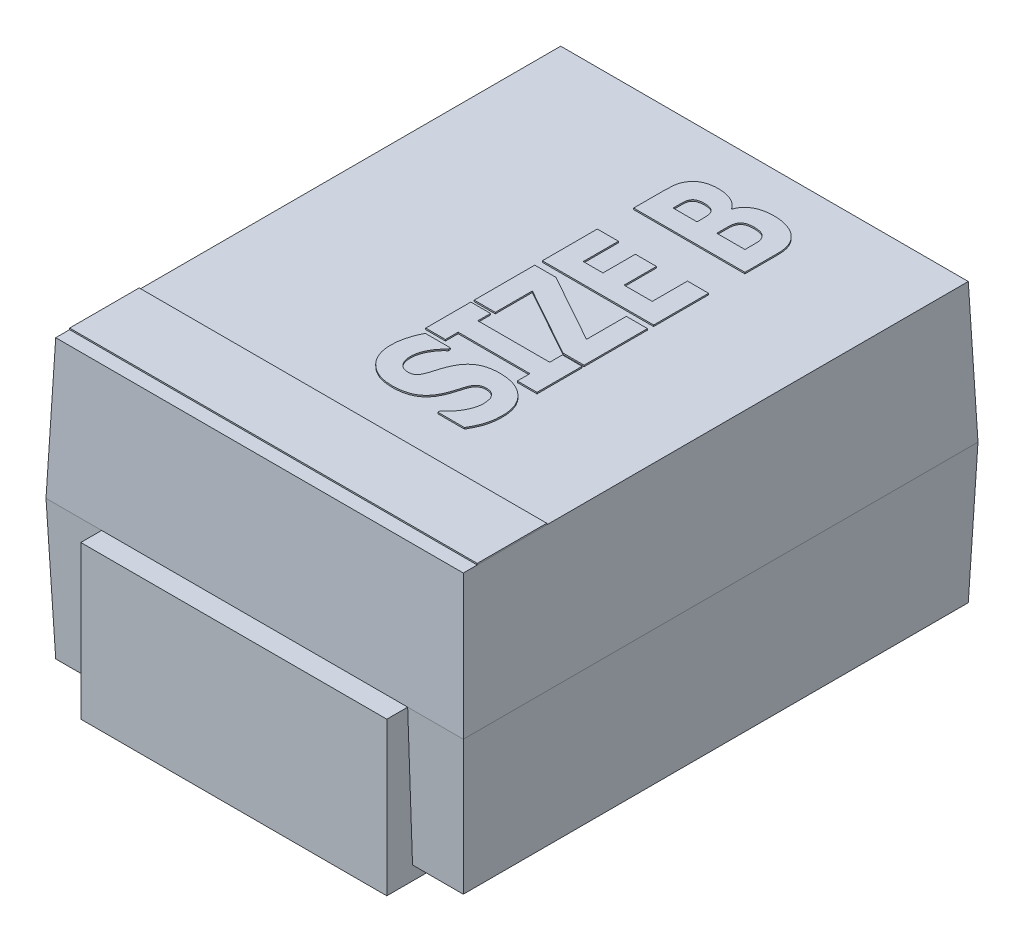
from build123d import *

# Parameters (mm, degrees)
SKETCH1_W                     = 3
SKETCH1_H                     = 3.7
BOSS_EXTRUDE1_DEPTH           = 1
BOSS_EXTRUDE1_TAPER           = 2
BOSS_EXTRUDE1_OTHER_WAY_DEPTH = 1
BOSS_EXTRUDE1_OTHER_WAY_TAPER = 2
BOSS_EXTRUDE2_DEPTH           = 0.1
BOSS_EXTRUDE2_DEPTH_BACK      = 1
SKETCH2_W                     = 2.2
SKETCH2_H                     = 1.35
SKETCH3_W                     = 2.930158462
SKETCH3_H                     = 0.5
EXTRUDE_THIN1_DEPTH           = 0.01
BOSS_EXTRUDE3_DEPTH           = 0.01


with BuildPart() as part:
    # Sketch1 → Boss-Extrude1 (new body)
    with BuildSketch(Plane(origin=(0, 0, 0), x_dir=(1, 0, 0), z_dir=(0, 1, 0))):
        Rectangle(SKETCH1_W, SKETCH1_H)
    extrude(amount=BOSS_EXTRUDE1_DEPTH, taper=BOSS_EXTRUDE1_TAPER)

    # Sketch1 → Boss-Extrude1 other way (add)
    with BuildSketch(Plane(origin=(0, 0, 0), x_dir=(1, 0, 0), z_dir=(0, 1, 0))):
        Rectangle(SKETCH1_W, SKETCH1_H)
    extrude(amount=-BOSS_EXTRUDE1_OTHER_WAY_DEPTH, taper=BOSS_EXTRUDE1_OTHER_WAY_TAPER)

    # Sketch2 → Boss-Extrude2 (add, two sides: drawn at the far end of the back side and taken through both)
    with BuildSketch(Plane.XZ.offset(1).offset(-BOSS_EXTRUDE2_DEPTH_BACK)):
        with Locations((0, 1.325)):
            Rectangle(SKETCH2_W, SKETCH2_H)
        with Locations((0, -1.325)):
            Rectangle(SKETCH2_W, SKETCH2_H)
    extrude(amount=BOSS_EXTRUDE2_DEPTH + BOSS_EXTRUDE2_DEPTH_BACK)

    # Sketch3 → Extrude-Thin1 (add)
    with BuildSketch(Plane(origin=(0, 1, 0), x_dir=(1, 0, 0), z_dir=(0, 1, 0))):
        with Locations((0, -1.465079231)):
            Rectangle(SKETCH3_W, SKETCH3_H)
    extrude(amount=EXTRUDE_THIN1_DEPTH)

    # Sketch4 → Boss-Extrude3 (add)
    # profile 1 of 5: a face of its own
    with BuildSketch(Plane(origin=(0, 1, 0), x_dir=(1, 0, 0), z_dir=(0, 1, 0))):
        with BuildLine():
            add(Edge.make_bspline(
                [(0.365712142, -0.449367089), (0.375477587, -0.449585808), (0.394586509, -0.450013797), (0.422548964, -0.453184881), (0.449056815, -0.458587497), (0.474219127, -0.465954588), (0.497898983, -0.475738978), (0.520333789, -0.487348438), (0.5411446, -0.501493547), (0.560614091, -0.517348749), (0.578125113, -0.535178263), (0.593466319, -0.55464831), (0.606472344, -0.575606586), (0.61721107, -0.598066109), (0.625217682, -0.622182753), (0.631022844, -0.647776451), (0.634817357, -0.674887089), (0.635158268, -0.693499619), (0.635332395, -0.703006329)],
                knots=[0, 0, 0, 0, 1.123231077, 2.197926755, 3.231931198, 4.23205902, 5.208893471, 6.175023653, 7.132504262, 8.098119942, 9.059150163, 10.001029427, 10.943846196, 11.890986852, 12.857973929, 13.860252586, 14.907082517, 16, 16, 16, 16], degree=3))
            add(Edge.make_bspline(
                [(0.635332395, -0.703006329), (0.635115242, -0.713931024), (0.634694654, -0.735090239), (0.631588553, -0.765807235), (0.626063457, -0.794334312), (0.618402145, -0.820873007), (0.608794987, -0.84570026), (0.598367575, -0.869706339), (0.586750204, -0.892933672), (0.577981534, -0.907800906), (0.573623534, -0.915189873)],
                knots=[0, 0, 0, 0, 1.170088317, 2.26625562, 3.302187664, 4.278401643, 5.220628038, 6.151609465, 7.08135594, 8, 8, 8, 8], degree=3))
            Line((0.573623534, -0.915189873), (0.382167838, -0.915189873))
            Line((0.382167838, -0.915189873), (0.382167838, -0.899683544))
            add(Edge.make_bspline(
                [(0.382167838, -0.899683544), (0.39076958, -0.892313259), (0.40765476, -0.877845423), (0.429750751, -0.853608827), (0.449012854, -0.828315552), (0.464822603, -0.801871713), (0.477559335, -0.77513376), (0.486597859, -0.748530664), (0.492575969, -0.722470456), (0.493237066, -0.705146194), (0.493560243, -0.696677215)],
                knots=[0, 0, 0, 0, 1.137748405, 2.233394795, 3.289549256, 4.328854387, 5.325001514, 6.260582723, 7.149684573, 8, 8, 8, 8], degree=3))
            add(Edge.make_bspline(
                [(0.493560243, -0.696677215), (0.493321944, -0.691659384), (0.492782712, -0.680304872), (0.490523317, -0.665704671), (0.488072343, -0.653007303), (0.485358825, -0.643929962), (0.48231823, -0.635644224), (0.479445586, -0.630818747), (0.478053914, -0.628481013)],
                knots=[0, 0, 0, 0, 1.279356194, 2.894969178, 3.759536177, 4.571858236, 5.308127055, 6, 6, 6, 6], degree=3))
            add(Edge.make_bspline(
                [(0.478053914, -0.628481013), (0.474196176, -0.623341147), (0.466520621, -0.613114603), (0.453759433, -0.602916998), (0.441713169, -0.596657245), (0.430547317, -0.593457824), (0.417529837, -0.591395282), (0.408179361, -0.591228069), (0.403212142, -0.591139241)],
                knots=[0, 0, 0, 0, 1.313748587, 2.613902296, 3.305346579, 4.085142053, 4.982776842, 6, 6, 6, 6], degree=3))
            add(Edge.make_bspline(
                [(0.403212142, -0.591139241), (0.398870896, -0.591308505), (0.390457131, -0.591636557), (0.378273869, -0.594577743), (0.367106465, -0.599552837), (0.356824495, -0.606408714), (0.347847994, -0.615320347), (0.339539697, -0.625681128), (0.332883792, -0.638178216), (0.32928352, -0.647220775), (0.327421003, -0.651898734)],
                knots=[0, 0, 0, 0, 0.997552441, 1.93335531, 2.862211005, 3.797699212, 4.758724122, 5.761134443, 6.841774632, 8, 8, 8, 8], degree=3))
            add(Edge.make_bspline(
                [(0.327421003, -0.651898734), (0.323860305, -0.662634809), (0.316578996, -0.684589123), (0.307093957, -0.718182807), (0.297105309, -0.751868081), (0.287523457, -0.773086271), (0.282800749, -0.783544304)],
                knots=[0, 0, 0, 0, 0.975309188, 1.994420259, 3.011488788, 4, 4, 4, 4], degree=3))
            add(Edge.make_bspline(
                [(0.282800749, -0.783544304), (0.27996648, -0.789222083), (0.274417155, -0.800338823), (0.265104153, -0.81615118), (0.254687989, -0.83044696), (0.24402217, -0.84395483), (0.232241772, -0.855902238), (0.219881751, -0.866791719), (0.206635022, -0.876288946), (0.192751303, -0.884720322), (0.177948795, -0.891823891), (0.162475187, -0.898244266), (0.145976247, -0.903387377), (0.128678515, -0.907607156), (0.110593294, -0.911197638), (0.091602278, -0.913454795), (0.071748684, -0.914938985), (0.058225582, -0.915105011), (0.051313408, -0.915189873)],
                knots=[0, 0, 0, 0, 1.073445682, 2.101740216, 3.099543666, 4.063832661, 5.010289146, 5.933583054, 6.847386585, 7.763973722, 8.677777253, 9.622212832, 10.59574541, 11.597689141, 12.633619916, 13.712650431, 14.830848108, 16, 16, 16, 16], degree=3))
            add(Edge.make_bspline(
                [(0.051313408, -0.915189873), (0.042074607, -0.914971055), (0.023963445, -0.914542098), (-0.002523219, -0.911361422), (-0.027699786, -0.906006472), (-0.0515213, -0.898352661), (-0.07414853, -0.888708456), (-0.095465069, -0.876763991), (-0.115439617, -0.862637836), (-0.133926843, -0.846505358), (-0.150639291, -0.828708348), (-0.165283685, -0.809545564), (-0.177517322, -0.789057174), (-0.187784763, -0.767499987), (-0.195447178, -0.744506284), (-0.201208216, -0.720436538), (-0.20455987, -0.695083831), (-0.204966447, -0.677805149), (-0.205173934, -0.668987342)],
                knots=[0, 0, 0, 0, 1.110899699, 2.17773761, 3.202861202, 4.201826735, 5.182111527, 6.156137979, 7.134615264, 8.119159157, 9.101903375, 10.066048987, 11.013525875, 11.96690795, 12.931720993, 13.922517702, 14.939801223, 16, 16, 16, 16], degree=3))
            add(Edge.make_bspline(
                [(-0.205173934, -0.668987342), (-0.204992983, -0.65996059), (-0.204630194, -0.641862797), (-0.201635257, -0.614859431), (-0.197094123, -0.587993554), (-0.190649346, -0.561618971), (-0.182544579, -0.536300122), (-0.173794568, -0.512285899), (-0.163886672, -0.490133429), (-0.156317884, -0.476325657), (-0.152642288, -0.469620253)],
                knots=[0, 0, 0, 0, 1.039519936, 2.084140277, 3.125876998, 4.176486779, 5.208308838, 6.186738043, 7.119434044, 8, 8, 8, 8], degree=3))
            Line((-0.152642288, -0.469620253), (0.027737458, -0.469620253))
            Line((0.027737458, -0.469620253), (0.027737458, -0.484968354))
            add(Edge.make_bspline(
                [(0.027737458, -0.484968354), (0.02137899, -0.490796852), (0.008616835, -0.502495297), (-0.008206569, -0.522574023), (-0.023883485, -0.544145949), (-0.037616244, -0.567421501), (-0.049068595, -0.59178064), (-0.057368986, -0.616771502), (-0.062520233, -0.642140333), (-0.063108347, -0.659206485), (-0.063401782, -0.667721519)],
                knots=[0, 0, 0, 0, 0.984070871, 1.97513988, 2.984813114, 4.027106165, 5.056510584, 6.052673032, 7.028395148, 8, 8, 8, 8], degree=3))
            add(Edge.make_bspline(
                [(-0.063401782, -0.667721519), (-0.063204685, -0.673691025), (-0.062808286, -0.685696795), (-0.060017638, -0.703682384), (-0.054490338, -0.721529343), (-0.048122319, -0.732331795), (-0.044889124, -0.737816456)],
                knots=[0, 0, 0, 0, 0.97418877, 1.959271968, 2.963873987, 4, 4, 4, 4], degree=3))
            add(Edge.make_bspline(
                [(-0.044889124, -0.737816456), (-0.043255512, -0.740178839), (-0.03990094, -0.745029919), (-0.033703944, -0.751662382), (-0.0262821, -0.757728162), (-0.017831742, -0.76321101), (-0.008466037, -0.767816079), (0.001745975, -0.77093265), (0.012454596, -0.773117756), (0.019867436, -0.773316844), (0.023623534, -0.773417722)],
                knots=[0, 0, 0, 0, 0.855403996, 1.756545736, 2.694648507, 3.706409739, 4.754179369, 5.793420774, 6.88192253, 8, 8, 8, 8], degree=3))
            add(Edge.make_bspline(
                [(0.023623534, -0.773417722), (0.028706704, -0.773224951), (0.038298518, -0.772861197), (0.051768018, -0.769632416), (0.063409204, -0.764433488), (0.073535058, -0.756725276), (0.082050619, -0.745764357), (0.09005296, -0.731608689), (0.097769857, -0.713780796), (0.102022747, -0.700415051), (0.104319737, -0.693196203)],
                knots=[0, 0, 0, 0, 0.977411615, 1.844351051, 2.648603566, 3.416320099, 4.267959932, 5.300768973, 6.542143255, 8, 8, 8, 8], degree=3))
            add(Edge.make_bspline(
                [(0.104319737, -0.693196203), (0.107331015, -0.683229212), (0.11324698, -0.66364803), (0.122072837, -0.634125941), (0.132574729, -0.604086061), (0.14155051, -0.584268588), (0.146250117, -0.573892405)],
                knots=[0, 0, 0, 0, 0.986893501, 1.938854128, 2.920809672, 4, 4, 4, 4], degree=3))
            add(Edge.make_bspline(
                [(0.146250117, -0.573892405), (0.148811608, -0.568735114), (0.153868899, -0.558552794), (0.162664192, -0.544194776), (0.171887984, -0.530727259), (0.181973609, -0.518421605), (0.192754568, -0.507200086), (0.204127285, -0.496880644), (0.216212257, -0.487612645), (0.229130544, -0.479550657), (0.242846831, -0.472322094), (0.25754933, -0.46624185), (0.273182017, -0.460950902), (0.289800655, -0.456732056), (0.307399417, -0.453416037), (0.32599775, -0.451065985), (0.345541631, -0.449629359), (0.358905847, -0.449455589), (0.365712142, -0.449367089)],
                knots=[0, 0, 0, 0, 1.027654046, 2.028953039, 3.003320805, 3.940198746, 4.865983912, 5.77942601, 6.679715928, 7.581088694, 8.495113097, 9.444776638, 10.41855265, 11.439497146, 12.50331839, 13.614116899, 14.784887726, 16, 16, 16, 16], degree=3))
        make_face()
    # profile 2 of 5: a face of its own
    with BuildSketch(Plane(origin=(0, 1, 0), x_dir=(1, 0, 0), z_dir=(0, 1, 0))):
        Polygon((0.615079231, -0.111139241), (0.615079231, -0.435189873), (0.473307079, -0.435189873), (0.473307079, -0.344050633), (-0.043148618, -0.344050633), (-0.043148618, -0.435189873), (-0.184920769, -0.435189873), (-0.184920769, -0.111139241), (-0.043148618, -0.111139241), (-0.043148618, -0.202278481), (0.473307079, -0.202278481), (0.473307079, -0.111139241), align=None)
    # profile 3 of 5: a face of its own
    with BuildSketch(Plane(origin=(0, 1, 0), x_dir=(1, 0, 0), z_dir=(0, 1, 0))):
        Polygon((0.615079231, 0.358734177), (0.615079231, -0.096962025), (0.463180496, -0.096962025), (-0.033022035, 0.179462025), (-0.033022035, -0.086835443), (-0.184920769, -0.086835443), (-0.184920769, 0.348607595), (-0.033022035, 0.348607595), (0.463180496, 0.072341772), (0.463180496, 0.358734177), align=None)
    # profile 4 of 5: a face of its own
    with BuildSketch(Plane(origin=(0, 1, 0), x_dir=(1, 0, 0), z_dir=(0, 1, 0))):
        Polygon((0.615079231, 0.798227848), (0.615079231, 0.403291139), (-0.184920769, 0.403291139), (-0.184920769, 0.798227848), (-0.033022035, 0.798227848), (-0.033022035, 0.545063291), (0.108750117, 0.545063291), (0.108750117, 0.777974684), (0.260648851, 0.777974684), (0.260648851, 0.545063291), (0.463180496, 0.545063291), (0.463180496, 0.798227848), align=None)
    # profile 5 of 5: a face of its own
    with BuildSketch(Plane(origin=(0, 1, 0), x_dir=(1, 0, 0), z_dir=(0, 1, 0))):
        with BuildLine():
            add(Edge.make_bspline(
                [(0.369667838, 1.515189873), (0.379117638, 1.515032635), (0.397540484, 1.514726092), (0.42436245, 1.51161963), (0.449617406, 1.50677766), (0.473252247, 1.500017846), (0.495068981, 1.491358378), (0.51526438, 1.48174911), (0.533382403, 1.470245037), (0.544121236, 1.46134773), (0.549414674, 1.456962025)],
                knots=[0, 0, 0, 0, 1.174436279, 2.289620837, 3.351881384, 4.3688092, 5.340546233, 6.2672784, 7.145898434, 8, 8, 8, 8], degree=3))
            add(Edge.make_bspline(
                [(0.549414674, 1.456962025), (0.555020706, 1.451700051), (0.565958298, 1.44143373), (0.579976075, 1.42440483), (0.591298948, 1.406498111), (0.600406078, 1.387635939), (0.607107234, 1.367035486), (0.611766898, 1.344217768), (0.614590148, 1.318899854), (0.614911708, 1.301168042), (0.615079231, 1.29193038)],
                knots=[0, 0, 0, 0, 1.002449623, 1.955819221, 2.868378433, 3.761000057, 4.681516283, 5.68700832, 6.79501116, 8, 8, 8, 8], degree=3))
            Line((0.615079231, 1.29193038), (0.615079231, 1.059493671))
            Line((0.615079231, 1.059493671), (-0.184920769, 1.059493671))
            Line((-0.184920769, 1.059493671), (-0.184920769, 1.268670886))
            add(Edge.make_bspline(
                [(-0.184920769, 1.268670886), (-0.184804446, 1.278797248), (-0.184588079, 1.297632718), (-0.183685835, 1.323728504), (-0.181570044, 1.345412268), (-0.179119363, 1.363566976), (-0.174526501, 1.379412044), (-0.168278178, 1.394502337), (-0.160232216, 1.409607245), (-0.153538371, 1.419159298), (-0.150110643, 1.424050633)],
                knots=[0, 0, 0, 0, 1.495008738, 2.780780584, 3.852192693, 4.711077229, 5.47999672, 6.279524168, 7.118993149, 8, 8, 8, 8], degree=3))
            add(Edge.make_bspline(
                [(-0.150110643, 1.424050633), (-0.146095797, 1.428995574), (-0.138062513, 1.43888988), (-0.123170528, 1.451200788), (-0.106594456, 1.461750241), (-0.088097093, 1.470249043), (-0.067985386, 1.47690596), (-0.046308453, 1.481347798), (-0.023346447, 1.484312137), (-0.007557173, 1.48464156), (0.000522268, 1.484810127)],
                knots=[0, 0, 0, 0, 0.905811704, 1.812433922, 2.738295642, 3.700075283, 4.705538743, 5.750786538, 6.849067563, 8, 8, 8, 8], degree=3))
            add(Edge.make_bspline(
                [(0.000522268, 1.484810127), (0.00986941, 1.48457267), (0.028117124, 1.484109103), (0.054627324, 1.480343633), (0.079361713, 1.473746827), (0.102370794, 1.464999967), (0.123300971, 1.453737711), (0.142030771, 1.440418865), (0.15829079, 1.424797042), (0.167039073, 1.412797092), (0.171408344, 1.406803797)],
                knots=[0, 0, 0, 0, 1.146126091, 2.237495015, 3.27462512, 4.280105132, 5.249652878, 6.181345612, 7.091685165, 8, 8, 8, 8], degree=3))
            Line((0.171408344, 1.406803797), (0.175838724, 1.406803797))
            add(Edge.make_bspline(
                [(0.175838724, 1.406803797), (0.177221249, 1.410903446), (0.179954632, 1.419008841), (0.185695535, 1.430455682), (0.192111841, 1.441449757), (0.199736474, 1.45170245), (0.208350139, 1.461316037), (0.218108047, 1.470124221), (0.228664183, 1.478600883), (0.240450962, 1.486195374), (0.253254672, 1.492911889), (0.266944744, 1.499039024), (0.281684732, 1.504039674), (0.297390718, 1.508146557), (0.314096074, 1.511323578), (0.331758113, 1.513425439), (0.350390462, 1.514953074), (0.363124393, 1.515109495), (0.369667838, 1.515189873)],
                knots=[0, 0, 0, 0, 0.869434446, 1.718954538, 2.570658915, 3.42809519, 4.284677413, 5.163387463, 6.069913846, 7.005897615, 7.979040287, 8.976751037, 10.020411215, 11.106579183, 12.240823529, 13.438565402, 14.683783687, 16, 16, 16, 16], degree=3))
        make_face()
        with BuildLine():
            add(Edge.make_bspline(
                [(0.037705813, 1.343037975), (0.030923094, 1.342748234), (0.017170147, 1.342160742), (0.000538381, 1.337780615), (-0.012190331, 1.332957373), (-0.020394658, 1.327671991), (-0.02753722, 1.321247013), (-0.030968484, 1.315965124), (-0.03270558, 1.313291139)],
                knots=[0, 0, 0, 0, 1.526769075, 3.095745762, 3.853179343, 4.585554278, 5.283929221, 6, 6, 6, 6], degree=3))
            add(Edge.make_bspline(
                [(-0.03270558, 1.313291139), (-0.034109997, 1.310691828), (-0.036968294, 1.305401659), (-0.039754147, 1.296444301), (-0.041619233, 1.286677361), (-0.0425185, 1.275754954), (-0.042647727, 1.263343277), (-0.043061318, 1.24889455), (-0.043175133, 1.232225839), (-0.04315779, 1.220358598), (-0.043148618, 1.214082278)],
                knots=[0, 0, 0, 0, 0.701793737, 1.428304497, 2.221101595, 3.065590151, 4.032579413, 5.175275482, 6.506065907, 8, 8, 8, 8], degree=3))
            Line((-0.043148618, 1.214082278), (-0.043148618, 1.201265823))
            Line((-0.043148618, 1.201265823), (0.129003281, 1.201265823))
            Line((0.129003281, 1.201265823), (0.129003281, 1.222468354))
            add(Edge.make_bspline(
                [(0.129003281, 1.222468354), (0.128964321, 1.22763738), (0.128889176, 1.237607123), (0.128559621, 1.251953349), (0.128145806, 1.265095064), (0.127359726, 1.277023575), (0.126258103, 1.287861495), (0.124049971, 1.297528017), (0.121002187, 1.306089534), (0.117959243, 1.310960515), (0.116503281, 1.313291139)],
                knots=[0, 0, 0, 0, 1.335852145, 2.576521239, 3.70858608, 4.733137905, 5.666399747, 6.519473329, 7.291610689, 8, 8, 8, 8], degree=3))
            add(Edge.make_bspline(
                [(0.116503281, 1.313291139), (0.114323885, 1.31616348), (0.110086621, 1.321747992), (0.102311844, 1.328736943), (0.093528576, 1.333991753), (0.080266083, 1.338884717), (0.061502352, 1.342291304), (0.045947513, 1.342779373), (0.037705813, 1.343037975)],
                knots=[0, 0, 0, 0, 0.736499587, 1.431930083, 2.124087551, 2.817505704, 4.313761825, 6, 6, 6, 6], degree=3))
        make_face(mode=Mode.SUBTRACT)
        with BuildLine():
            add(Edge.make_bspline(
                [(0.370142522, 1.373417722), (0.364073336, 1.373292692), (0.352593107, 1.37305619), (0.336473273, 1.37142303), (0.322485038, 1.368473397), (0.310565571, 1.364230825), (0.300321292, 1.358544955), (0.291645105, 1.35114819), (0.284415604, 1.34195446), (0.280838685, 1.334932337), (0.279003281, 1.331329114)],
                knots=[0, 0, 0, 0, 1.360206882, 2.572913163, 3.625556313, 4.556697352, 5.39829734, 6.236820169, 7.095269443, 8, 8, 8, 8], degree=3))
            add(Edge.make_bspline(
                [(0.279003281, 1.331329114), (0.277881244, 1.328450519), (0.275517579, 1.322386519), (0.273159971, 1.312180564), (0.271909073, 1.300556279), (0.270860513, 1.282929008), (0.270998368, 1.259438442), (0.270850693, 1.240294366), (0.270775433, 1.230537975)],
                knots=[0, 0, 0, 0, 0.546101267, 1.150407549, 1.846013188, 2.612602236, 4.273681324, 6, 6, 6, 6], degree=3))
            Line((0.270775433, 1.230537975), (0.270775433, 1.201265823))
            Line((0.270775433, 1.201265823), (0.473307079, 1.201265823))
            Line((0.473307079, 1.201265823), (0.473307079, 1.211075949))
            add(Edge.make_bspline(
                [(0.473307079, 1.211075949), (0.473324066, 1.219778577), (0.473355569, 1.235918181), (0.473158233, 1.258069388), (0.473010742, 1.276267807), (0.472847476, 1.291049833), (0.47188809, 1.303772433), (0.469142084, 1.315379486), (0.464858522, 1.326569291), (0.460707606, 1.333390384), (0.458591889, 1.336867089)],
                knots=[0, 0, 0, 0, 1.62476404, 3.013233683, 4.135841116, 5.022294843, 5.773838683, 6.511908119, 7.241521057, 8, 8, 8, 8], degree=3))
            add(Edge.make_bspline(
                [(0.458591889, 1.336867089), (0.456215144, 1.340168631), (0.451589544, 1.346594066), (0.442954356, 1.354754332), (0.433075087, 1.361044424), (0.422142127, 1.365805733), (0.410304588, 1.369206248), (0.397662891, 1.371761), (0.384150559, 1.373150994), (0.374892302, 1.373327281), (0.370142522, 1.373417722)],
                knots=[0, 0, 0, 0, 0.974323377, 1.896219819, 2.82976391, 3.770142237, 4.746927067, 5.779171223, 6.860644045, 8, 8, 8, 8], degree=3))
        make_face(mode=Mode.SUBTRACT)
    extrude(amount=BOSS_EXTRUDE3_DEPTH)


solid = part.part
